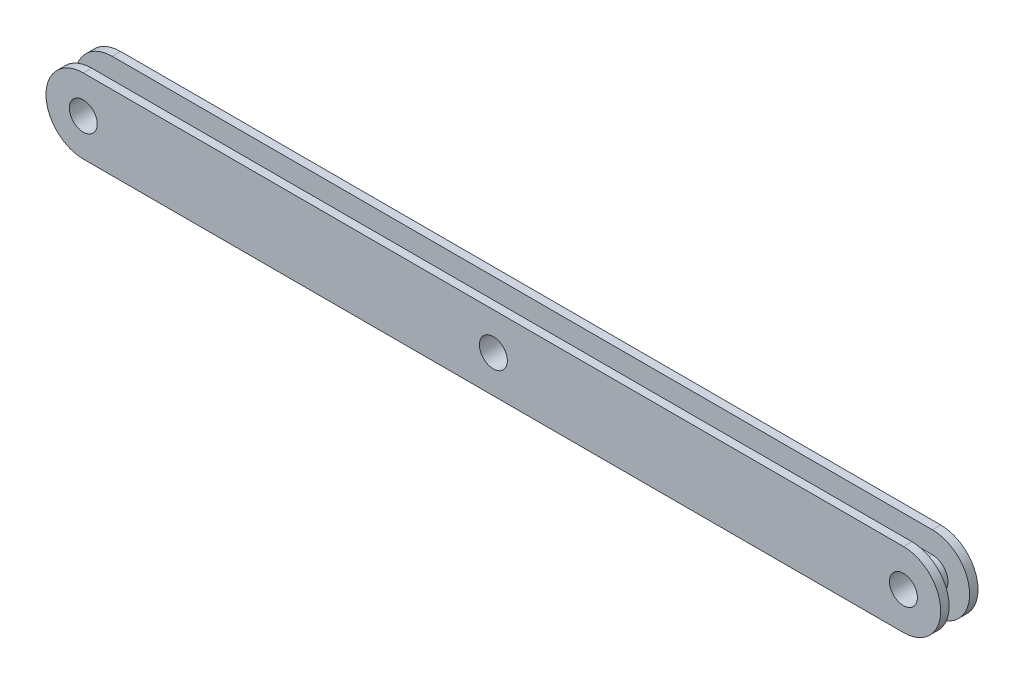
from build123d import *

# Parameters (mm, degrees)
ESQUISSE1_W             = 152.4
ESQUISSE1_H             = 12.7
BOSS_EXTRU_1_DEPTH      = 6.35
ESQUISSE2_R             = 2.38125
ENL_V_MAT_EXTRU_1_DEPTH = 154.060029074
SKETCH1_W               = 14.17076538
SKETCH1_H               = 3.495000122
CUT_REVOLVE1_ANGLE      = 180
SKETCH2_W               = 3.495000122
SKETCH2_H               = 3.683
CUT_EXTRUDE1_DEPTH      = 154.060029074


with BuildPart() as part:
    # Esquisse1 → Boss.-Extru.1 (new body)
    with BuildSketch(Plane.XY):
        with Locations((-76.2, 6.35)):
            Rectangle(ESQUISSE1_W, ESQUISSE1_H)
    extrude(amount=-BOSS_EXTRU_1_DEPTH)

    # Esquisse2 → Enlèv. mat.-Extru.1 (cut, through all)
    with BuildSketch(Plane.XY):
        with Locations((-146.05, 6.35)):
            Circle(ESQUISSE2_R)
        with Locations((-76.2, 6.35)):
            Circle(ESQUISSE2_R)
        with Locations((-6.35, 6.35)):
            Circle(ESQUISSE2_R)
        with BuildLine():
            Line((0, 12.7), (-6.35, 12.7))
            ThreePointArc((-6.35, 12.7), (-1.859871939, 10.840128061), (0, 6.35))
            Line((0, 6.35), (0, 12.7))
        make_face()
        with BuildLine():
            Line((0, 0), (0, 6.35))
            ThreePointArc((0, 6.35), (-1.859871939, 1.859871939), (-6.35, 0))
            Line((-6.35, 0), (0, 0))
        make_face()
        with BuildLine():
            ThreePointArc((-152.4, 6.35), (-150.540128061, 10.840128061), (-146.05, 12.7))
            Line((-146.05, 12.7), (-152.4, 12.7))
            Line((-152.4, 12.7), (-152.4, 6.35))
        make_face()
        with BuildLine():
            ThreePointArc((-146.05, 0), (-150.540128061, 1.859871939), (-152.4, 6.35))
            Line((-152.4, 6.35), (-152.4, 0))
            Line((-152.4, 0), (-146.05, 0))
        make_face()
    extrude(amount=-ENL_V_MAT_EXTRU_1_DEPTH, mode=Mode.SUBTRACT)

    # Sketch1 → Cut-Revolve1 (revolve, symmetric, cut)
    with BuildSketch(Plane(origin=(0, 6.35, 0), x_dir=(1, 0, 0), z_dir=(0, 1, 0))) as cut_revolve1_sk:
        Polygon((-150.5585, 1.427499939), (-152.4, 1.427499939), (-152.4, 4.922500061), (-150.5585, 4.922500061), (-148.717, 4.922500061), (-148.717, 1.427499939), align=None)
        with Locations((-159.48538269, 3.175)):
            Rectangle(SKETCH1_W, SKETCH1_H)
    cut_revolve1 = revolve(axis=Axis((-146.05, 6.35, -6.35), (0, 0, 1)), revolution_arc=CUT_REVOLVE1_ANGLE / 2, mode=Mode.SUBTRACT)
    cut_revolve1 = cut_revolve1 + revolve(cut_revolve1_sk.sketch, axis=Axis((-146.05, 6.35, -6.35), (0, 0, -1)), revolution_arc=CUT_REVOLVE1_ANGLE / 2, mode=Mode.SUBTRACT)

    # Mirror1: Cut-Revolve1 across plane
    add(cut_revolve1.mirror(Plane(origin=(-76.2, 0, 0), x_dir=(0, 0, 1), z_dir=(1, 0, 0))), mode=Mode.SUBTRACT)

    # Sketch2 → Cut-Extrude1 (cut, through all)
    with BuildSketch(Plane(origin=(0, 0, 0), x_dir=(0, 0, -1), z_dir=(1, 0, 0))):
        with Locations((3.175, 10.8585)):
            Rectangle(SKETCH2_W, SKETCH2_H)
    cut_extrude1 = extrude(amount=-CUT_EXTRUDE1_DEPTH, mode=Mode.SUBTRACT)

    # Mirror2: Cut-Extrude1 across plane
    add(cut_extrude1.mirror(Plane.ZX.offset(6.35)), mode=Mode.SUBTRACT)


solid = part.part
